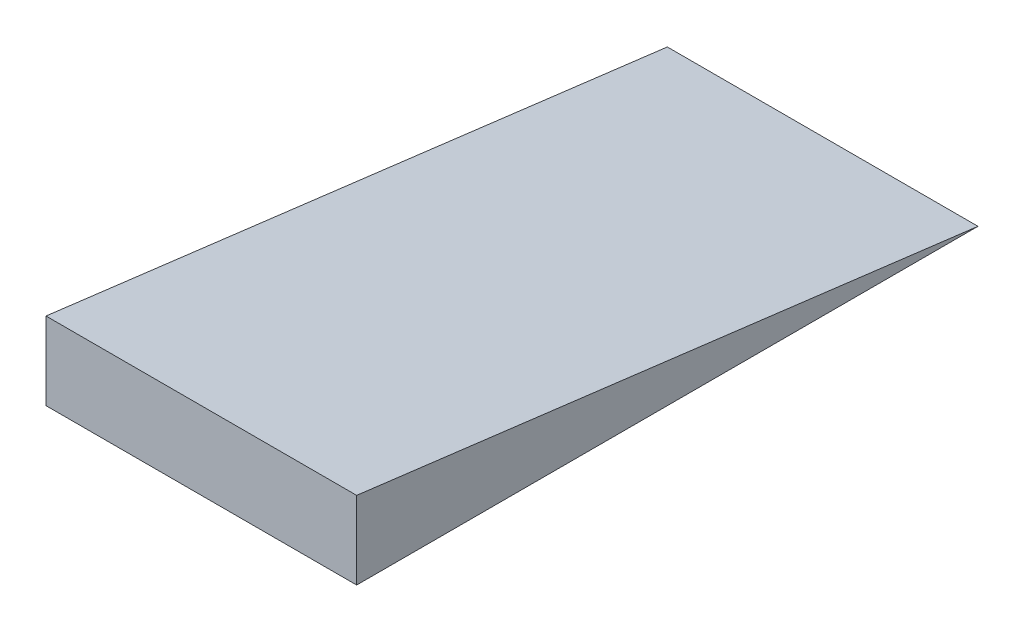
from build123d import *

# Parameters (mm, degrees)
EXTRUDE_1_DEPTH = 800


with BuildPart() as part:
    # 草图1 → 凸台-拉伸1 (new body)
    with BuildSketch(Plane(origin=(0, 0, 0), x_dir=(0, 0, -1), z_dir=(1, 0, 0))):
        Polygon((0, 100), (0, -100), (1600, -100), align=None)
    extrude(amount=EXTRUDE_1_DEPTH)


solid = part.part
